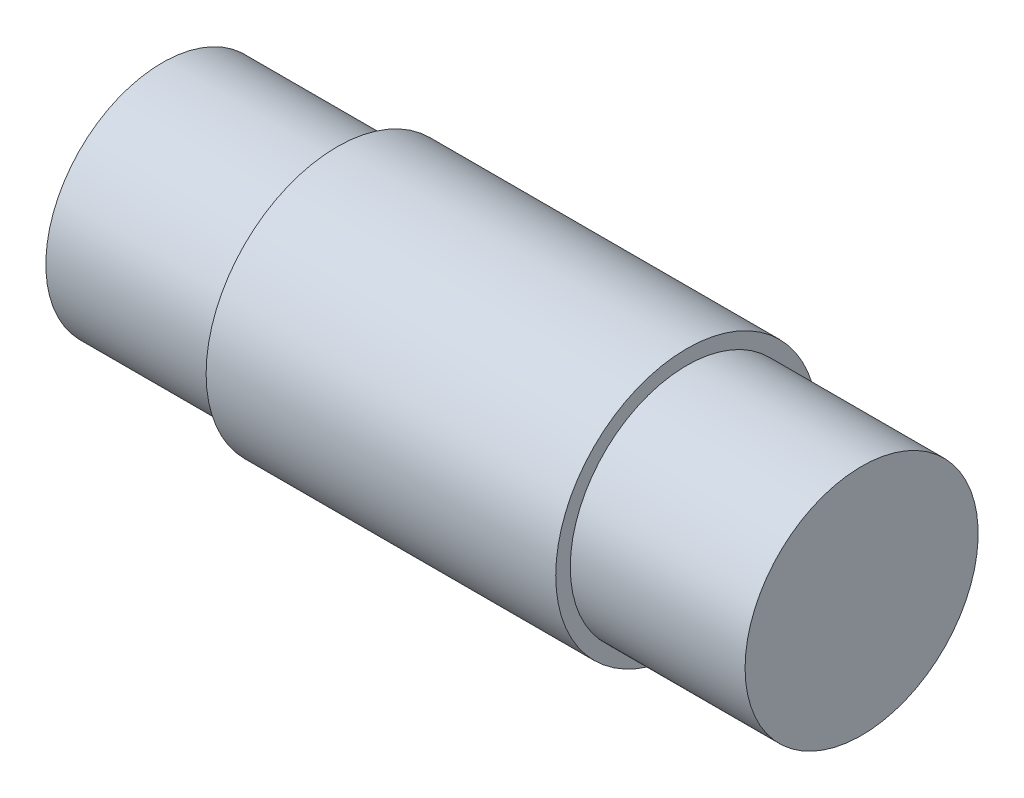
from build123d import *

# Parameters (mm, degrees)
SKETCH2_R           = 3.175
BOSS_EXTRUDE1_DEPTH = 2.38125
SKETCH3_R           = 3.57124
BOSS_EXTRUDE2_DEPTH = 9.525
SKETCH5_R           = 3.175
BOSS_EXTRUDE3_DEPTH = 4.7625


with BuildPart() as part:
    # Sketch2 → Boss-Extrude1 (new, symmetric)
    with BuildSketch(Plane(origin=(0, 0, 0), x_dir=(0, 0, -1), z_dir=(1, 0, 0))):
        with Locations(Location((0, 0, 0), (0, 0, 180))):
            Circle(SKETCH2_R)
    extrude(amount=BOSS_EXTRUDE1_DEPTH, both=True)

    # Sketch3 → Boss-Extrude2 (add)
    with BuildSketch(Plane.ZY.offset(2.38125)):
        with Locations(Location((0, 0, 0), (0, 0, 180))):
            Circle(SKETCH3_R)
    extrude(amount=BOSS_EXTRUDE2_DEPTH)

    # Sketch5 → Boss-Extrude3 (add)
    with BuildSketch(Plane.ZY.offset(11.90625)):
        Circle(SKETCH5_R)
    extrude(amount=BOSS_EXTRUDE3_DEPTH)


solid = part.part
